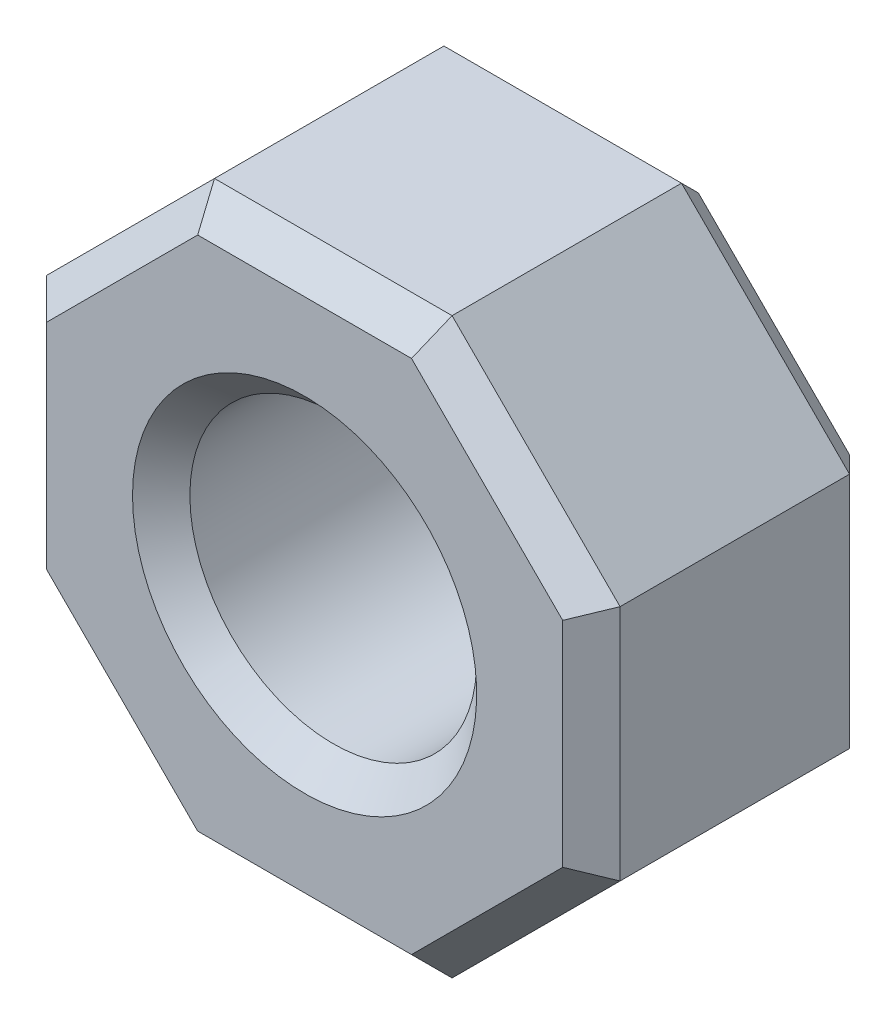
from build123d import *

# Parameters (mm, degrees)
SKETCH2_R      = 12.5
EXTRUDE2_DEPTH = 25
CHAMFER3_SIZE  = 2.5
CHAMFER4_SIZE  = 2.5


with BuildPart() as part:
    # Sketch2 → Extrude2 (new body)
    with BuildSketch(Plane.XY):
        Polygon((-25, 10.355339059), (-10.355339059, 25), (10.355339059, 25), (25, 10.355339059), (25, -10.355339059), (10.355339059, -25), (-10.355339059, -25), (-25, -10.355339059), align=None)
        Circle(SKETCH2_R, mode=Mode.SUBTRACT)
    extrude(amount=EXTRUDE2_DEPTH)

    # Chamfer3
    chamfer3_edges = [part.edges().sort_by_distance(p)[0] for p in [
        (-12.5, 0, 0),
        (17.67766953, 17.67766953, 0),
        (25, 0, 0),
        (17.67766953, -17.67766953, 0),
        (0, -25, 0),
        (-17.67766953, -17.67766953, 0),
        (-25, 0, 0),
        (-17.67766953, 17.67766953, 0),
        (0, 25, 0),
    ]]
    chamfer(chamfer3_edges, length=CHAMFER3_SIZE)

    # Chamfer4
    chamfer4_edges = [part.edges().sort_by_distance(p)[0] for p in [
        (-25, 0, 25),
        (-17.67766953, -17.67766953, 25),
        (0, -25, 25),
        (17.67766953, -17.67766953, 25),
        (-12.5, 0, 25),
        (25, 0, 25),
        (17.67766953, 17.67766953, 25),
        (0, 25, 25),
        (-17.67766953, 17.67766953, 25),
    ]]
    chamfer(chamfer4_edges, length=CHAMFER4_SIZE)


solid = part.part
